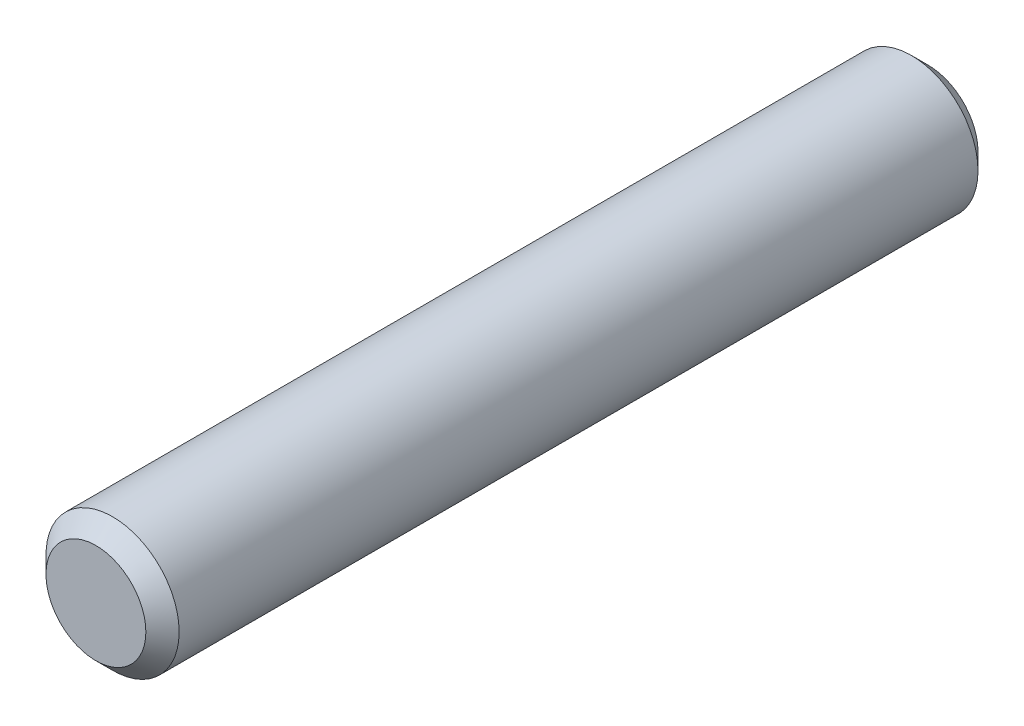
from build123d import *

# Parameters (mm, degrees)
SCHIZZO1_R                   = 4
ESTRUSIONE_ESTRUSIONE1_DEPTH = 50
SMUSSO1_SIZE                 = 1


with BuildPart() as part:
    # Schizzo1 → Estrusione-Estrusione1 (new body)
    with BuildSketch(Plane.XY):
        Circle(SCHIZZO1_R)
    extrude(amount=ESTRUSIONE_ESTRUSIONE1_DEPTH)

    # Smusso1
    smusso1_edges = [part.edges().sort_by_distance(p)[0] for p in [
        (-4, 0, 0),
        (-4, 0, 50),
    ]]
    chamfer(smusso1_edges, length=SMUSSO1_SIZE)


solid = part.part
